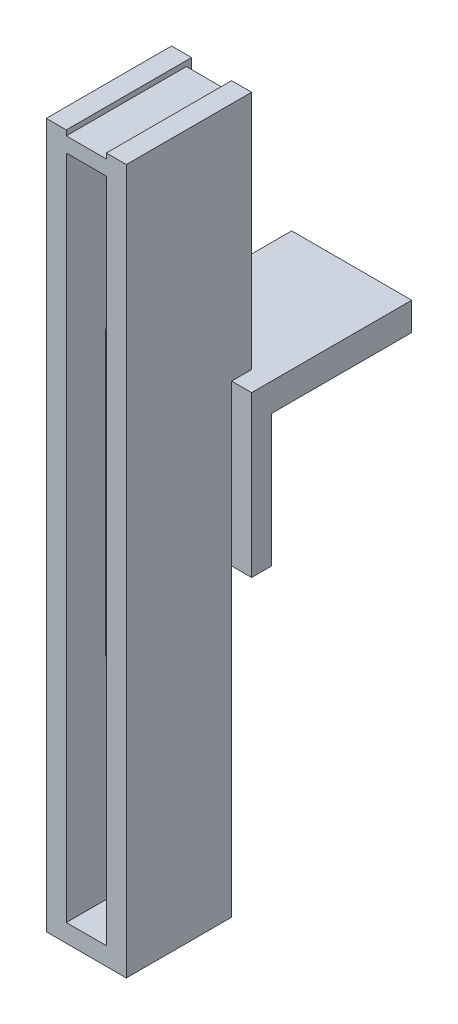
from build123d import *

# Parameters (mm, degrees)
BOSS_EXTRUDE2_DEPTH = 15
BOSS_EXTRUDE3_DEPTH = 5
BOSS_EXTRUDE4_DEPTH = 5
BOSS_EXTRUDE5_DEPTH = 10
SKETCH9_W           = 10
SKETCH9_H           = 4.5
BOSS_EXTRUDE6_DEPTH = 17.8


with BuildPart() as part:
    # Sketch2 → Boss-Extrude2 (new, symmetric)
    with BuildSketch(Plane(origin=(0, 0, 0), x_dir=(0, 0, -1), z_dir=(1, 0, 0))):
        Polygon((0, 0), (0, -40), (5, -40), (5, -7), (40, -7), (40, 0), align=None)
    extrude(amount=BOSS_EXTRUDE2_DEPTH, both=True)

    # Sketch3 → Boss-Extrude3 (add, symmetric)
    with BuildSketch(Plane(origin=(0, 0, 0), x_dir=(0, 0, -1), z_dir=(1, 0, 0))):
        Polygon((0, -116), (-8.5, -116), (-8.5, -71.626882213), (-16.532330081, -58.612316561), (-16.532330081, 11.829172037), (0, 40.464007705), align=None)
    extrude(amount=BOSS_EXTRUDE3_DEPTH, both=True)

    # Sketch4 → Boss-Extrude4 (add)
    with BuildSketch(Plane.ZY.offset(5)):
        Polygon((0, 60), (26.3, 60), (26.3, -116), (0, -116), (0, 0), (-5, 0), (-5, 60), align=None)
    boss_extrude4 = extrude(amount=BOSS_EXTRUDE4_DEPTH)

    # Mirror1: Boss-Extrude4 across plane
    add(boss_extrude4.mirror(Plane(origin=(0, 0, 0), x_dir=(0, 0, 1), z_dir=(1, 0, 0))))

    # Sketch8 → Boss-Extrude5 (add)
    with BuildSketch(Plane.ZY.offset(-5)):
        Polygon((0, 0), (0, 55), (26.3, 55), (26.3, 58.7), (-3.7, 58.7), (-3.7, 0), align=None)
    extrude(amount=BOSS_EXTRUDE5_DEPTH)

    # Sketch9 → Boss-Extrude6 (add)
    with BuildSketch(Plane.XY.offset(8.5)):
        with Locations((0, -113.75)):
            Rectangle(SKETCH9_W, SKETCH9_H)
    extrude(amount=BOSS_EXTRUDE6_DEPTH)


solid = part.part
